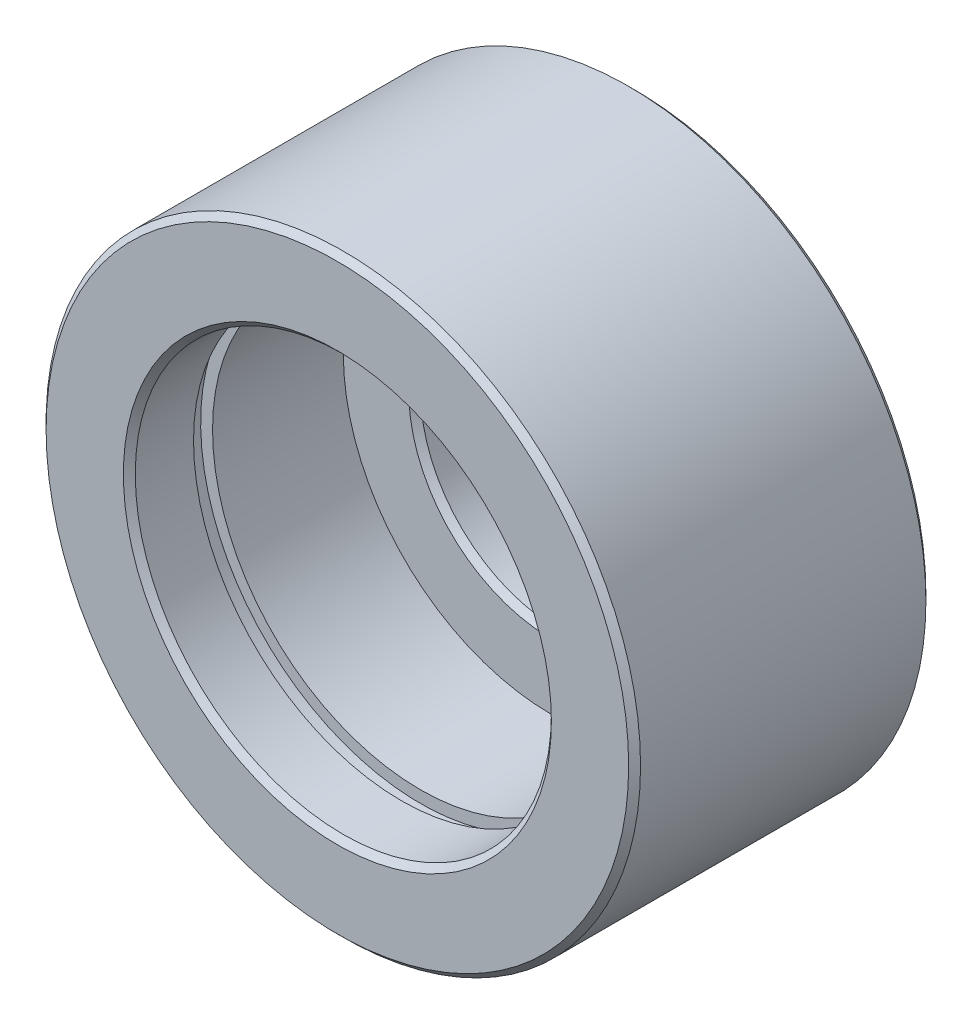
from build123d import *

# Parameters (mm, degrees)
ESBO_O1_R                = 25
RESSALTO_EXTRUS_O1_DEPTH = 12.5
ESBO_O3_R                = 11.5
CORTE_EXTRUS_O1_DEPTH    = 25
ESBO_O4_R                = 17.5
CORTE_EXTRUS_O2_DEPTH    = 18
CHANFRO1_SIZE            = 0.5
ESBO_O5_W                = 1.6
ESBO_O5_H                = 18.5


with BuildPart() as part:
    # Esboço1 → Ressalto-extrusão1 (new, symmetric)
    with BuildSketch(Plane.XY):
        Circle(ESBO_O1_R)
    extrude(amount=RESSALTO_EXTRUS_O1_DEPTH, both=True)

    # Esboço3 → Corte-extrusão1 (cut)
    with BuildSketch(Plane.XY.offset(12.5)):
        Circle(ESBO_O3_R)
    extrude(amount=-CORTE_EXTRUS_O1_DEPTH, mode=Mode.SUBTRACT)

    # Esboço4 → Corte-extrusão2 (cut)
    with BuildSketch(Plane.XY.offset(12.5)):
        Circle(ESBO_O4_R)
    extrude(amount=-CORTE_EXTRUS_O2_DEPTH, mode=Mode.SUBTRACT)

    # Chanfro1
    chanfro1_edges = [part.edges().sort_by_distance(p)[0] for p in [
        (-17.5, 0, 12.5),
        (-11.5, 0, -5.5),
        (-25, 0, -12.5),
        (-25, 0, 12.5),
        (-11.5, 0, -12.5),
    ]]
    chamfer(chanfro1_edges, length=CHANFRO1_SIZE)

    # Esboço5 → Corte-Revolução2 (revolve, cut)
    with BuildSketch(Plane(origin=(0, 0, 0), x_dir=(0, 0, -1), z_dir=(1, 0, 0)), mode=Mode.PRIVATE) as corte_revolu_o2_sk:
        with Locations((-6.3, 9.25)):
            Rectangle(ESBO_O5_W, ESBO_O5_H)
    revolve(corte_revolu_o2_sk.sketch.rotate(Axis((0, 0, 5.5), (0, 0, 1)), 270), axis=Axis((0, 0, 5.5), (0, 0, 1)), mode=Mode.SUBTRACT)


solid = part.part
